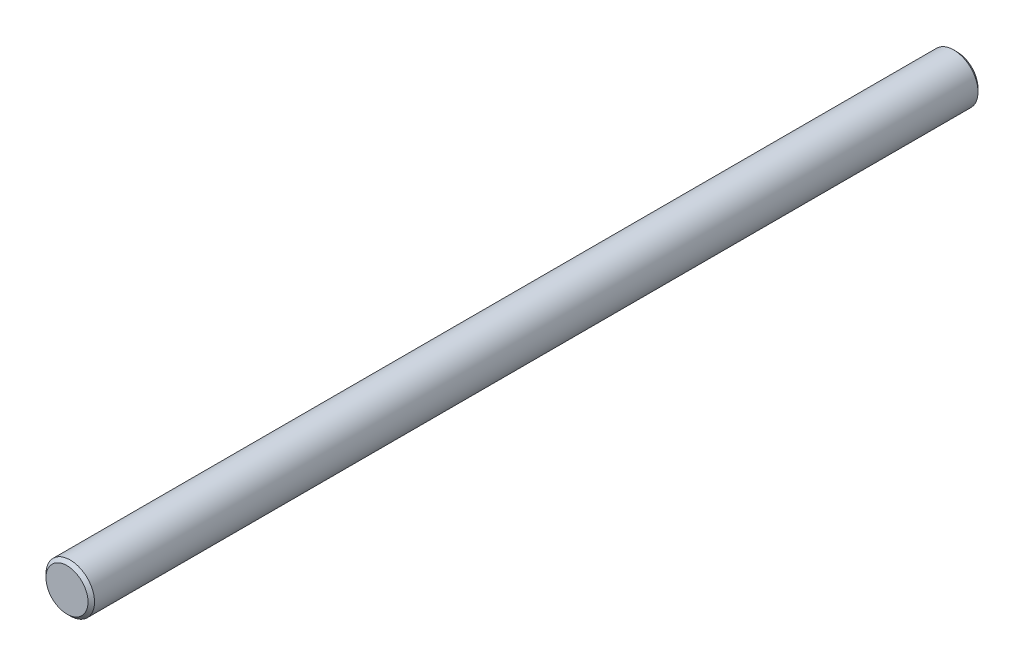
from build123d import *

# Parameters (mm, degrees)
SKETCH1_R           = 1.5
BOSS_EXTRUDE1_DEPTH = 55
CHAMFER1_SIZE       = 0.2


with BuildPart() as part:
    # Sketch1 → Boss-Extrude1 (new body)
    with BuildSketch(Plane.XY):
        Circle(SKETCH1_R)
    extrude(amount=BOSS_EXTRUDE1_DEPTH)

    # Chamfer1
    chamfer1_edges = [part.edges().sort_by_distance(p)[0] for p in [
        (-1.5, 0, 0),
        (-1.5, 0, 55),
    ]]
    chamfer(chamfer1_edges, length=CHAMFER1_SIZE)


solid = part.part
